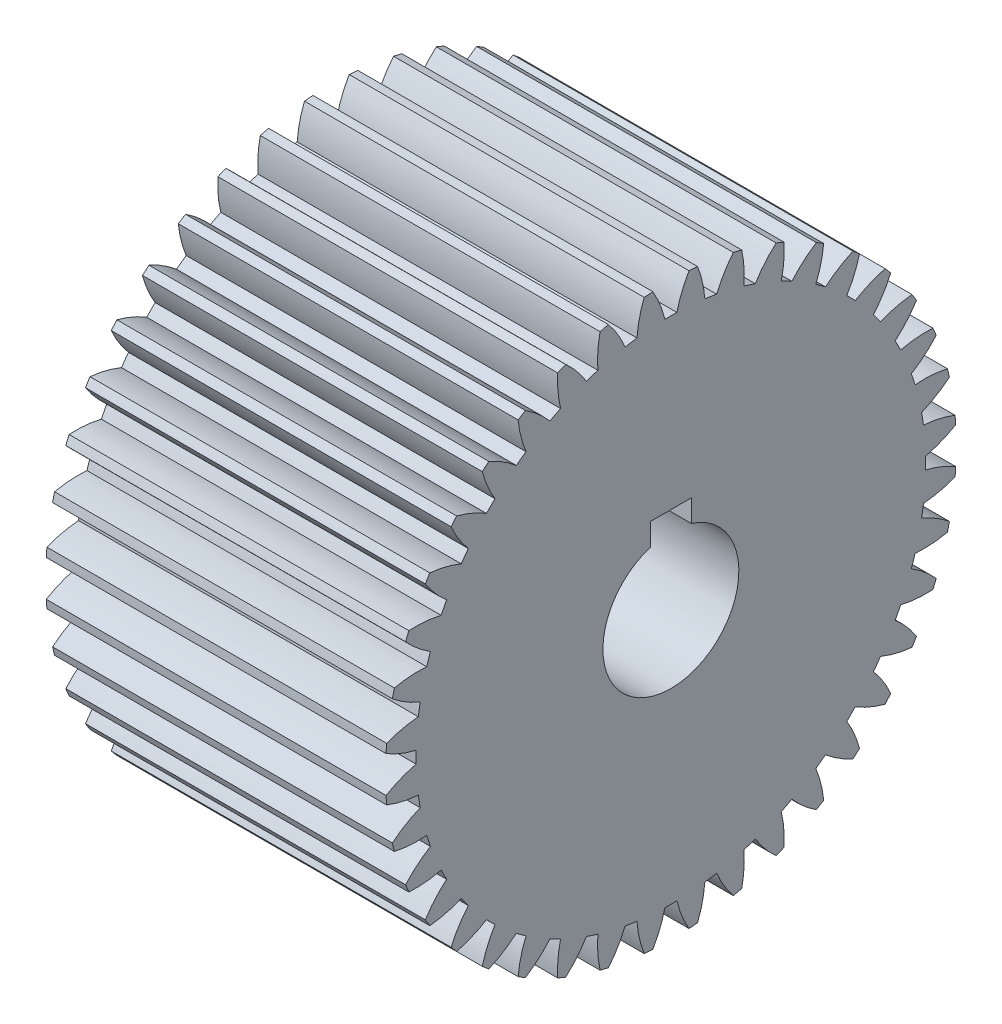
from build123d import *

# Parameters (mm, degrees)
BASPROSKE_W     = 50
BASPROSKE_H     = 42
TOOTHCUT_DEPTH  = 78.640195775
TEETHCUTS_COUNT = 40
TEETHCUTS_ANGLE = 351
BORSKE_R        = 10
BORE_DEPTH      = 50.0000508
KEYSKE_W        = 6
KEYSKE_H        = 12.8
KEYWAY_DEPTH    = 50.0000508


with BuildPart() as part:
    # BasProSke → Base-Revolve (revolve)
    with BuildSketch(Plane(origin=(0, 0, 0), x_dir=(1, 0, 0), z_dir=(0, 1, 0)), mode=Mode.PRIVATE) as base_revolve_sk:
        with Locations((25, 21)):
            Rectangle(BASPROSKE_W, BASPROSKE_H)
    revolve(base_revolve_sk.sketch.rotate(Axis((-10, 0, 0), (1, 0, 0)), 180), axis=Axis((-10, 0, 0), (1, 0, 0)))

    # TooCutSke → ToothCut (cut, through all)
    with BuildSketch(Plane(origin=(0, 0, 0), x_dir=(0, 0, -1), z_dir=(1, 0, 0))):
        with BuildLine():
            ThreePointArc((0.882812088, 37.488606854), (0, 37.499), (-0.882812088, 37.488606854))
            ThreePointArc((-0.882812088, 37.488606854), (-1.612748684, 39.782000434), (-2.678427154, 41.939960338))
            ThreePointArc((-2.678427154, 41.939960338), (0, 42.0254), (2.678427154, 41.939960338))
            ThreePointArc((2.678427154, 41.939960338), (1.612748684, 39.782000434), (0.882812088, 37.488606854))
        make_face()
    toothcut = extrude(amount=TOOTHCUT_DEPTH, mode=Mode.SUBTRACT)

    # TeethCuts: ToothCut ×40 about axis
    teethcuts_axis = Axis((-10, 0, 0), (1, 0, 0))
    for i in range(1, TEETHCUTS_COUNT):
        add(toothcut.rotate(teethcuts_axis, i * TEETHCUTS_ANGLE / (TEETHCUTS_COUNT - 1)), mode=Mode.SUBTRACT)

    # BorSke → Bore (cut, symmetric)
    with BuildSketch(Plane(origin=(0, 0, 0), x_dir=(0, 0, -1), z_dir=(1, 0, 0))):
        with Locations(Location((0, 0, 0), (0, 0, 180))):
            Circle(BORSKE_R)
    extrude(amount=BORE_DEPTH, both=True, mode=Mode.SUBTRACT)

    # KeySke → Keyway (cut, symmetric)
    with BuildSketch(Plane(origin=(0, 0, 0), x_dir=(0, 0, -1), z_dir=(1, 0, 0))):
        with Locations((0, 6.4)):
            Rectangle(KEYSKE_W, KEYSKE_H)
    extrude(amount=KEYWAY_DEPTH, both=True, mode=Mode.SUBTRACT)


solid = part.part
